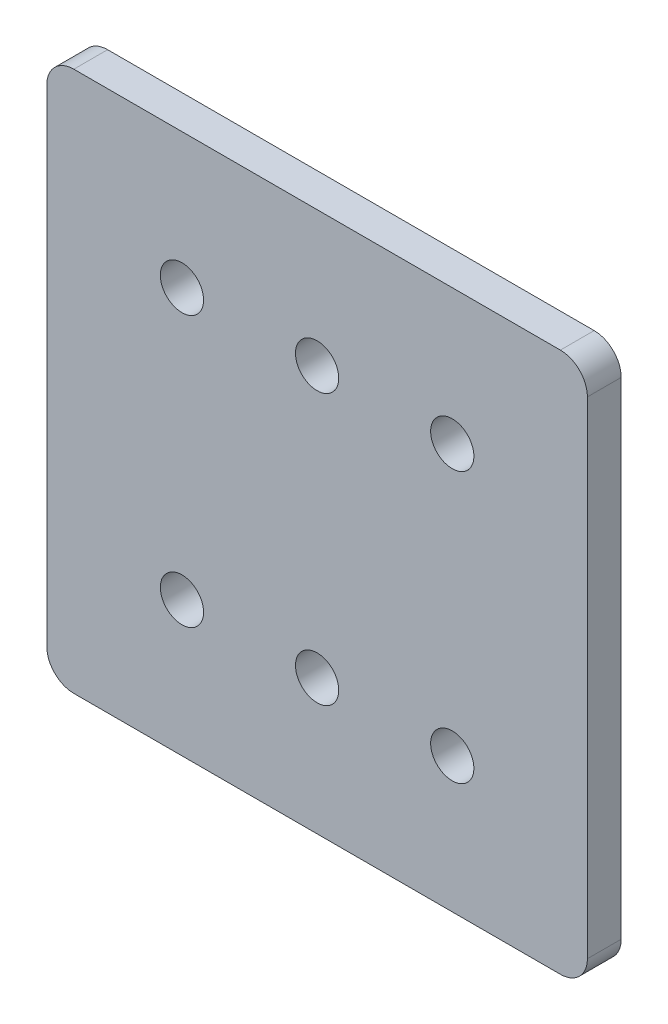
from build123d import *

# Parameters (mm, degrees)
SKETCH1_W           = 50.8
SKETCH1_H           = 50.8
BOSS_EXTRUDE1_DEPTH = 1.5875
FILLET1_R           = 2.54
SKETCH2_R           = 2.032
CUT_EXTRUDE1_DEPTH  = 37.061067996


with BuildPart() as part:
    # Sketch1 → Boss-Extrude1 (new, symmetric)
    with BuildSketch(Plane.XY):
        Rectangle(SKETCH1_W, SKETCH1_H)
    extrude(amount=BOSS_EXTRUDE1_DEPTH, both=True)

    # Fillet1
    fillet1_edges = [part.edges().sort_by_distance(p)[0] for p in [
        (25.4, -25.4, 0),
        (-25.4, -25.4, 0),
        (-25.4, 25.4, 0),
        (25.4, 25.4, 0),
    ]]
    fillet(fillet1_edges, radius=FILLET1_R)

    # Sketch2 → Cut-Extrude1 (cut, through all)
    with BuildSketch(Plane.XY.offset(1.5875)):
        with Locations((-12.7, 12.7)):
            Circle(SKETCH2_R)
        with Locations((0, 12.7)):
            Circle(SKETCH2_R)
        with Locations((12.7, 12.7)):
            Circle(SKETCH2_R)
        with Locations(Location((12.7, -12.7, 0), (0, 0, 180))):
            Circle(SKETCH2_R)
        with Locations(Location((0, -12.7, 0), (0, 0, 180))):
            Circle(SKETCH2_R)
        with Locations(Location((-12.7, -12.7, 0), (0, 0, 180))):
            Circle(SKETCH2_R)
    extrude(amount=-CUT_EXTRUDE1_DEPTH, mode=Mode.SUBTRACT)


solid = part.part
